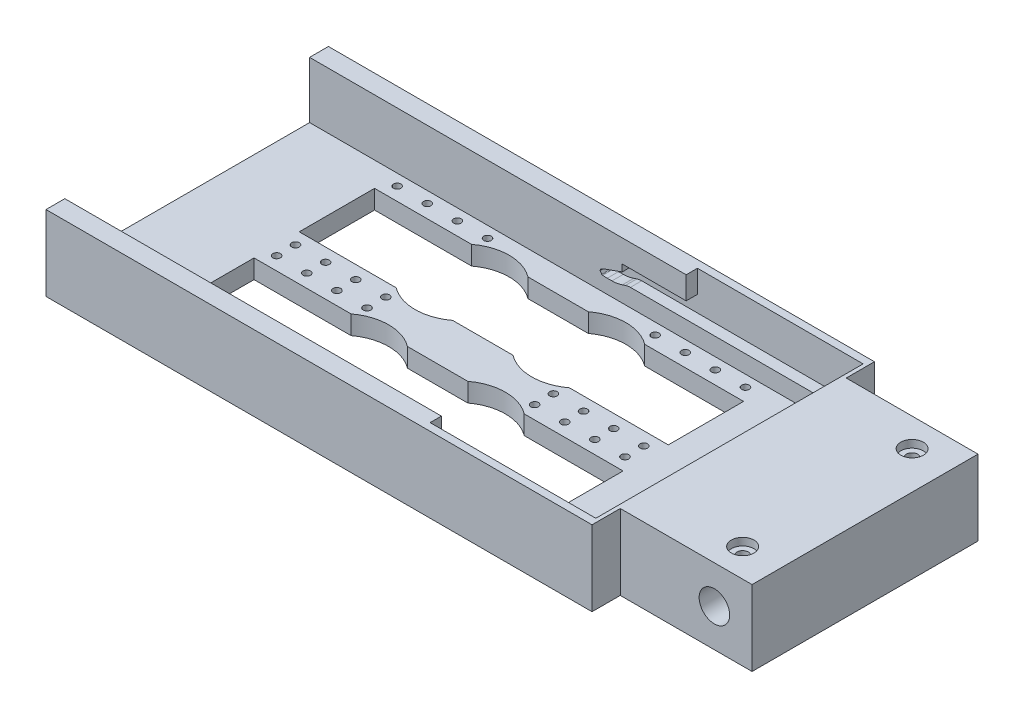
from build123d import *

# Parameters (mm, degrees)
SKETCH1_W           = 180
SKETCH1_H           = 75
SKETCH1_R           = 1.5
BOSS_EXTRUDE1_DEPTH = 20
SKETCH2_R           = 4.05
CUT_EXTRUDE1_DEPTH  = 119.84864324
SKETCH3_R           = 1
CUT_EXTRUDE2_DEPTH  = 100.530146245
SKETCH6_W           = 35
SKETCH6_H           = 7.5
CUT_EXTRUDE3_DEPTH  = 100.530146245
SKETCH7_W           = 140
SKETCH7_H           = 65
CUT_EXTRUDE4_DEPTH  = 15
SKETCH11_R          = 3
CUT_EXTRUDE7_DEPTH  = 2
CUT_EXTRUDE8_DEPTH  = 35.5


with BuildPart() as part:
    # Sketch1 → Boss-Extrude1 (new body)
    with BuildSketch(Plane(origin=(0, 0, 0), x_dir=(1, 0, 0), z_dir=(0, 1, 0))):
        Rectangle(SKETCH1_W, SKETCH1_H)
        with Locations(Location((80, 22.5, 0), (0, 0, 270))):
            Circle(SKETCH1_R, mode=Mode.SUBTRACT)
        with Locations(Location((80, -22.5, 0), (0, 0, 270))):
            Circle(SKETCH1_R, mode=Mode.SUBTRACT)
    extrude(amount=BOSS_EXTRUDE1_DEPTH)

    # Sketch2 → Cut-Extrude1 (cut, through all)
    with BuildSketch(Plane.XY.offset(37.5)):
        with Locations((80, 10)):
            Circle(SKETCH2_R)
    extrude(amount=-CUT_EXTRUDE1_DEPTH, mode=Mode.SUBTRACT)

    # Sketch3 → Cut-Extrude2 (cut, through all)
    with BuildSketch(Plane(origin=(0, 20, 0), x_dir=(1, 0, 0), z_dir=(0, 1, 0))):
        with Locations(Location((-63.75, 29.5, 0), (0, 0, 270))):
            Circle(SKETCH3_R)
        with Locations(Location((-63.75, 2.5, 0), (0, 0, 270))):
            Circle(SKETCH3_R)
        with Locations(Location((-55.75, 29.5, 0), (0, 0, 270))):
            Circle(SKETCH3_R)
        with Locations(Location((-47.75, 29.5, 0), (0, 0, 270))):
            Circle(SKETCH3_R)
        with Locations(Location((-39.75, 29.5, 0), (0, 0, 270))):
            Circle(SKETCH3_R)
        with Locations(Location((-55.75, 2.5, 0), (0, 0, 270))):
            Circle(SKETCH3_R)
        with Locations(Location((-47.75, 2.5, 0), (0, 0, 270))):
            Circle(SKETCH3_R)
        with Locations(Location((-39.75, 2.5, 0), (0, 0, 270))):
            Circle(SKETCH3_R)
        with Locations(Location((4.75, 29.5, 0), (0, 0, 270))):
            Circle(SKETCH3_R)
        with Locations(Location((4.75, 2.5, 0), (0, 0, 270))):
            Circle(SKETCH3_R)
        with Locations(Location((12.75, 29.5, 0), (0, 0, 270))):
            Circle(SKETCH3_R)
        with Locations(Location((20.75, 29.5, 0), (0, 0, 270))):
            Circle(SKETCH3_R)
        with Locations(Location((28.75, 29.5, 0), (0, 0, 270))):
            Circle(SKETCH3_R)
        with Locations(Location((12.75, 2.5, 0), (0, 0, 270))):
            Circle(SKETCH3_R)
        with Locations(Location((20.75, 2.5, 0), (0, 0, 270))):
            Circle(SKETCH3_R)
        with Locations(Location((28.75, 2.5, 0), (0, 0, 270))):
            Circle(SKETCH3_R)
        with Locations(Location((28.75, -2.5, 0), (0, 0, 90))):
            Circle(SKETCH3_R)
        with Locations(Location((20.75, -2.5, 0), (0, 0, 90))):
            Circle(SKETCH3_R)
        with Locations(Location((12.75, -2.5, 0), (0, 0, 90))):
            Circle(SKETCH3_R)
        with Locations(Location((28.75, -29.5, 0), (0, 0, 90))):
            Circle(SKETCH3_R)
        with Locations(Location((20.75, -29.5, 0), (0, 0, 90))):
            Circle(SKETCH3_R)
        with Locations(Location((12.75, -29.5, 0), (0, 0, 90))):
            Circle(SKETCH3_R)
        with Locations(Location((4.75, -2.5, 0), (0, 0, 90))):
            Circle(SKETCH3_R)
        with Locations(Location((4.75, -29.5, 0), (0, 0, 90))):
            Circle(SKETCH3_R)
        with Locations(Location((-39.75, -2.5, 0), (0, 0, 90))):
            Circle(SKETCH3_R)
        with Locations(Location((-47.75, -2.5, 0), (0, 0, 90))):
            Circle(SKETCH3_R)
        with Locations(Location((-55.75, -2.5, 0), (0, 0, 90))):
            Circle(SKETCH3_R)
        with Locations(Location((-39.75, -29.5, 0), (0, 0, 90))):
            Circle(SKETCH3_R)
        with Locations(Location((-47.75, -29.5, 0), (0, 0, 90))):
            Circle(SKETCH3_R)
        with Locations(Location((-55.75, -29.5, 0), (0, 0, 90))):
            Circle(SKETCH3_R)
        with Locations(Location((-63.75, -2.5, 0), (0, 0, 90))):
            Circle(SKETCH3_R)
        with Locations(Location((-63.75, -29.5, 0), (0, 0, 90))):
            Circle(SKETCH3_R)
        with BuildLine():
            Line((-66.25, 26), (-40.5, 26))
            ThreePointArc((-40.5, 26), (-33, 28.5), (-25.5, 26))
            Line((-25.5, 26), (-9.5, 26))
            ThreePointArc((-9.5, 26), (-2, 28.5), (5.5, 26))
            Line((5.5, 26), (31.75, 26))
            Line((31.75, 26), (31.75, 6))
            Line((31.75, 6), (5.5, 6))
            ThreePointArc((5.5, 6), (-2, 3.5), (-9.5, 6))
            Line((-9.5, 6), (-25.5, 6))
            ThreePointArc((-25.5, 6), (-33, 3.5), (-40.5, 6))
            Line((-40.5, 6), (-66.25, 6))
            Line((-66.25, 6), (-66.25, 26))
        make_face()
        with BuildLine():
            Line((31.75, -26), (31.75, -6))
            Line((31.75, -6), (5.5, -6))
            ThreePointArc((5.5, -6), (-2, -3.5), (-9.5, -6))
            Line((-9.5, -6), (-25.5, -6))
            ThreePointArc((-25.5, -6), (-33, -3.5), (-40.5, -6))
            Line((-40.5, -6), (-66.25, -6))
            Line((-66.25, -6), (-66.25, -26))
            Line((-66.25, -26), (-40.5, -26))
            ThreePointArc((-40.5, -26), (-33, -28.5), (-25.5, -26))
            Line((-25.5, -26), (-9.5, -26))
            ThreePointArc((-9.5, -26), (-2, -28.5), (5.5, -26))
            Line((5.5, -26), (31.75, -26))
        make_face()
    extrude(amount=-CUT_EXTRUDE2_DEPTH, mode=Mode.SUBTRACT)

    # Sketch6 → Cut-Extrude3 (cut, through all)
    with BuildSketch(Plane(origin=(0, 20, 0), x_dir=(1, 0, 0), z_dir=(0, 1, 0))):
        with Locations((72.5, 33.75)):
            Rectangle(SKETCH6_W, SKETCH6_H)
        with Locations((72.5, -33.75)):
            Rectangle(SKETCH6_W, SKETCH6_H)
    extrude(amount=-CUT_EXTRUDE3_DEPTH, mode=Mode.SUBTRACT)

    # Sketch7 → Cut-Extrude4 (cut)
    with BuildSketch(Plane(origin=(0, 20, 0), x_dir=(1, 0, 0), z_dir=(0, 1, 0))):
        with Locations((-20, 0)):
            Rectangle(SKETCH7_W, SKETCH7_H)
    extrude(amount=-CUT_EXTRUDE4_DEPTH, mode=Mode.SUBTRACT)

    # Sketch11 → Cut-Extrude7 (cut)
    with BuildSketch(Plane(origin=(0, 20, 0), x_dir=(1, 0, 0), z_dir=(0, 1, 0))):
        with Locations(Location((80, 22.5, 0), (0, 0, 270))):
            Circle(SKETCH11_R)
        with Locations(Location((80, -22.5, 0), (0, 0, 270))):
            Circle(SKETCH11_R)
    extrude(amount=-CUT_EXTRUDE7_DEPTH, mode=Mode.SUBTRACT)

    # Sketch10 → Cut-Extrude8 (cut, symmetric)
    with BuildSketch(Plane.XY):
        with BuildLine():
            Line((-4.813303769, 9.701023796), (15.9425, 9.701023796))
            Line((15.9425, 9.701023796), (54, 9.701023796))
            Line((54, 9.701023796), (54, 20))
            Line((54, 20), (10, 20))
            Line((10, 20), (10, 13.992782732))
            Line((10, 13.992782732), (-6.973901646, 13.992782732))
            Line((-6.973901646, 13.992782732), (-6.973901646, 12.163379208))
            Line((-6.973901646, 12.163379208), (-11.564583534, 10.528409745))
            Line((-11.564583534, 10.528409745), (-12.441268534, 10.145587097))
            ThreePointArc((-12.441268534, 10.145587097), (-12.502855993, 10.111608784), (-12.557147741, 10.066888019))
            Line((-12.557147741, 10.066888019), (-12.674186764, 9.950764236))
            ThreePointArc((-12.674186764, 9.950764236), (-12.728098338, 9.883549003), (-12.76552775, 9.805938536))
            Line((-12.76552775, 9.805938536), (-12.844609257, 9.579534995))
            ThreePointArc((-12.844609257, 9.579534995), (-12.847058857, 9.556485806), (-12.839013942, 9.534747706))
            Line((-12.839013942, 9.534747706), (-12.430389162, 8.917295446))
            ThreePointArc((-12.430389162, 8.917295446), (-12.351689773, 8.841149949), (-12.248247679, 8.805213007))
            Line((-12.248247679, 8.805213007), (-12.159561373, 8.794780397))
            ThreePointArc((-12.159561373, 8.794780397), (-11.558059052, 8.743286197), (-10.954502782, 8.73))
            Line((-10.954502782, 8.73), (-9.69369739, 8.742212661))
            ThreePointArc((-9.69369739, 8.742212661), (-8.292495674, 8.867093143), (-6.928536148, 9.211441509))
            Line((-6.928536148, 9.211441509), (-6.116741147, 9.486328538))
            ThreePointArc((-6.116741147, 9.486328538), (-5.473804157, 9.646990783), (-4.813303769, 9.701023796))
        make_face()
    extrude(amount=CUT_EXTRUDE8_DEPTH, both=True, mode=Mode.SUBTRACT)


solid = part.part
